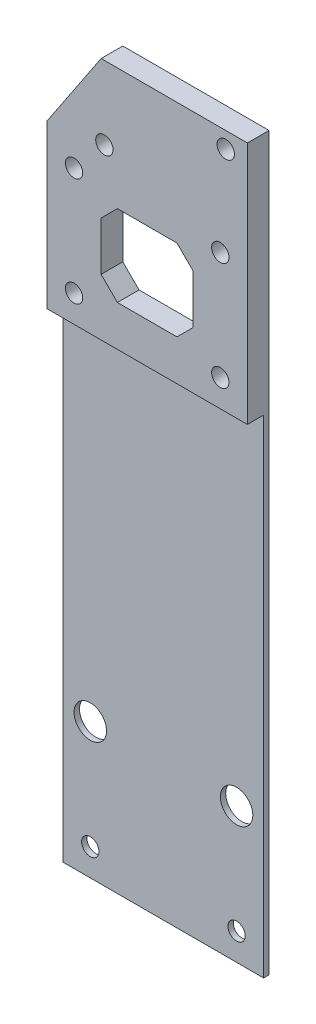
from build123d import *

# Parameters (mm, degrees)
SKETCH_1_W          = 37
SKETCH_1_H          = 120
SKETCH_1_R          = 1.6
SKETCH_1_R_2        = 3
EXTRUDE_1_DEPTH     = 4
SKETCH_2_W          = 37
SKETCH_2_H          = 90
CUT_EXTRUDE_1_DEPTH = 3
SKETCH_3_W          = 17
SKETCH_3_H          = 15
CUT_EXTRUDE_2_DEPTH = 63.914624691
CHAMFER_1_SIZE      = 3
EXTRUDE_2_DEPTH     = 4
SKETCH_5_R          = 1.6
CUT_EXTRUDE_3_DEPTH = 78.351470574


with BuildPart() as part:
    # ｽｹｯﾁ1 → ﾎﾞｽ - 押し出し1 (new body)
    # profile 1 of 2: a face of its own
    with BuildSketch(Plane.XY):
        Rectangle(SKETCH_1_W, SKETCH_1_H)
        with Locations((13.5, -55)):
            Circle(SKETCH_1_R, mode=Mode.SUBTRACT)
        with Locations((13.5, -35)):
            Circle(SKETCH_1_R_2, mode=Mode.SUBTRACT)
        with Locations((-13.5, -55)):
            Circle(SKETCH_1_R, mode=Mode.SUBTRACT)
        with Locations((-13.5, -35)):
            Circle(SKETCH_1_R_2, mode=Mode.SUBTRACT)
        with Locations((13.5, 35)):
            Circle(SKETCH_1_R, mode=Mode.SUBTRACT)
        with Locations((13.5, 55)):
            Circle(SKETCH_1_R, mode=Mode.SUBTRACT)
        with Locations((-13.5, 35)):
            Circle(SKETCH_1_R, mode=Mode.SUBTRACT)
        with Locations((-13.5, 55)):
            Circle(SKETCH_1_R, mode=Mode.SUBTRACT)
    # profile 2 of 2: a face of its own
    with BuildSketch(Plane.XY):
        Polygon((-18.5, -25), (-18.5, -60), (18.5, -60), (18.5, 60), (-18.5, 60), (-18.5, 25), align=None)
        with Locations((-13.5, -55)):
            Circle(SKETCH_1_R, mode=Mode.SUBTRACT)
        with Locations((-13.5, -35)):
            Circle(SKETCH_1_R_2, mode=Mode.SUBTRACT)
        with Locations((13.5, -55)):
            Circle(SKETCH_1_R, mode=Mode.SUBTRACT)
        with Locations((13.5, -35)):
            Circle(SKETCH_1_R_2, mode=Mode.SUBTRACT)
        with Locations((-13.5, 35)):
            Circle(SKETCH_1_R, mode=Mode.SUBTRACT)
        with Locations((-13.5, 55)):
            Circle(SKETCH_1_R, mode=Mode.SUBTRACT)
        with Locations((13.5, 35)):
            Circle(SKETCH_1_R, mode=Mode.SUBTRACT)
        with Locations((13.5, 55)):
            Circle(SKETCH_1_R, mode=Mode.SUBTRACT)
    extrude(amount=EXTRUDE_1_DEPTH)

    # ｽｹｯﾁ2 → ｶｯﾄ - 押し出し1 (cut)
    with BuildSketch(Plane.XY.offset(4)):
        with Locations((0, -15)):
            Rectangle(SKETCH_2_W, SKETCH_2_H)
    extrude(amount=-CUT_EXTRUDE_1_DEPTH, mode=Mode.SUBTRACT)

    # ｽｹｯﾁ3 → ｶｯﾄ - 押し出し2 (cut, through all)
    with BuildSketch(Plane(origin=(0, 0, 0), x_dir=(-1, 0, 0), z_dir=(0, 0, -1))):
        with Locations((0, 45)):
            Rectangle(SKETCH_3_W, SKETCH_3_H)
    extrude(amount=-CUT_EXTRUDE_2_DEPTH, mode=Mode.SUBTRACT)

    # 面取り1
    chamfer_1_edges = [part.edges().sort_by_distance(p)[0] for p in [
        (8.5, 37.5, 2),
        (8.5, 52.5, 2),
        (-8.5, 52.5, 2),
        (-8.5, 37.5, 2),
    ]]
    chamfer(chamfer_1_edges, length=CHAMFER_1_SIZE)

    # ｽｹｯﾁ4 → ﾎﾞｽ - 押し出し2 (add, through all)
    with BuildSketch(Plane.XY.offset(4)):
        Polygon((18.5, 75), (18.5, 60), (-18.5, 60), (-8.5, 75), align=None)
    extrude(amount=-EXTRUDE_2_DEPTH)

    # ｽｹｯﾁ5 → ｶｯﾄ - 押し出し3 (cut, through all)
    with BuildSketch(Plane.XY.offset(4)):
        with Locations((14.5, 72)):
            Circle(SKETCH_5_R)
        with Locations((-7.9, 61.5)):
            Circle(SKETCH_5_R)
    extrude(amount=-CUT_EXTRUDE_3_DEPTH, mode=Mode.SUBTRACT)


solid = part.part
